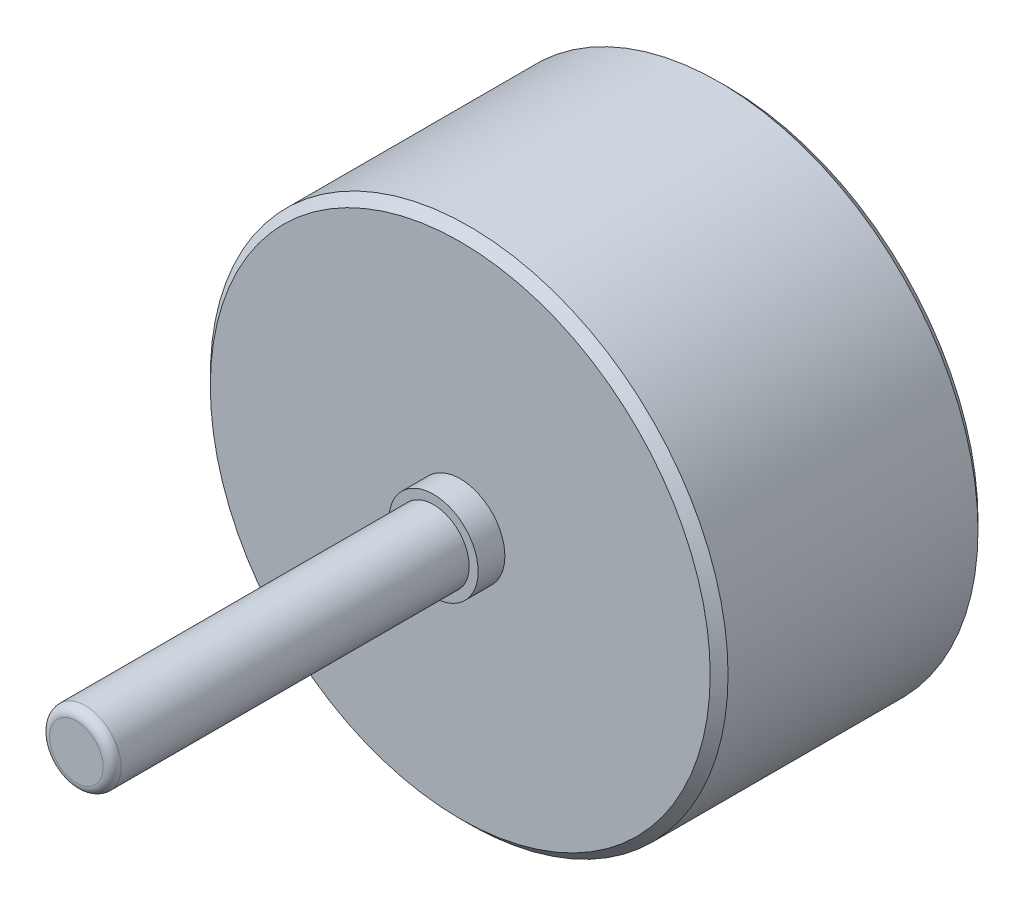
from build123d import *

# Parameters (mm, degrees)
ESQUISSE1_R             = 29
BOSS_EXTRU_1_DEPTH      = 30
ESQUISSE2_R             = 4
BOSS_EXTRU_2_DEPTH      = 10.25
ESQUISSE3_R             = 5
BOSS_EXTRU_3_DEPTH      = 3
ESQUISSE4_R             = 4
ENL_V_MAT_EXTRU_1_DEPTH = 5
CHANFREIN1_SIZE         = 1
ESQUISSE8_R             = 4
BOSS_EXTRU_4_DEPTH      = 32.75
CONG_1_R                = 1


with BuildPart() as part:
    # Esquisse1 → Boss.-Extru.1 (new body)
    with BuildSketch(Plane.XY):
        Circle(ESQUISSE1_R)
    extrude(amount=BOSS_EXTRU_1_DEPTH)

    # Esquisse2 → Boss.-Extru.2 (add)
    with BuildSketch(Plane.XY.offset(30)):
        Circle(ESQUISSE2_R)
    extrude(amount=BOSS_EXTRU_2_DEPTH)

    # Esquisse3 → Boss.-Extru.3 (add)
    with BuildSketch(Plane.XY.offset(30)):
        Circle(ESQUISSE3_R)
    extrude(amount=BOSS_EXTRU_3_DEPTH)

    # Esquisse4 → Enlèv. mat.-Extru.1 (cut)
    with BuildSketch(Plane(origin=(0, 0, 0), x_dir=(-1, 0, 0), z_dir=(0, 0, -1))):
        with Locations(Location((0, 0, 0), (0, 0, 180))):
            Circle(ESQUISSE4_R)
    extrude(amount=-ENL_V_MAT_EXTRU_1_DEPTH, mode=Mode.SUBTRACT)

    # Chanfrein1
    chanfrein1_edges = [part.edges().sort_by_distance(p)[0] for p in [
        (-29, 0, 0),
        (-29, 0, 30),
    ]]
    chamfer(chanfrein1_edges, length=CHANFREIN1_SIZE)

    # Esquisse8 → Boss.-Extru.4 (add)
    with BuildSketch(Plane.XY.offset(40.25)):
        Circle(ESQUISSE8_R)
    extrude(amount=BOSS_EXTRU_4_DEPTH)

    # Congé1
    cong_1_edges = [part.edges().sort_by_distance(p)[0] for p in [
        (-4, 0, 73),
    ]]
    fillet(cong_1_edges, radius=CONG_1_R)


solid = part.part
